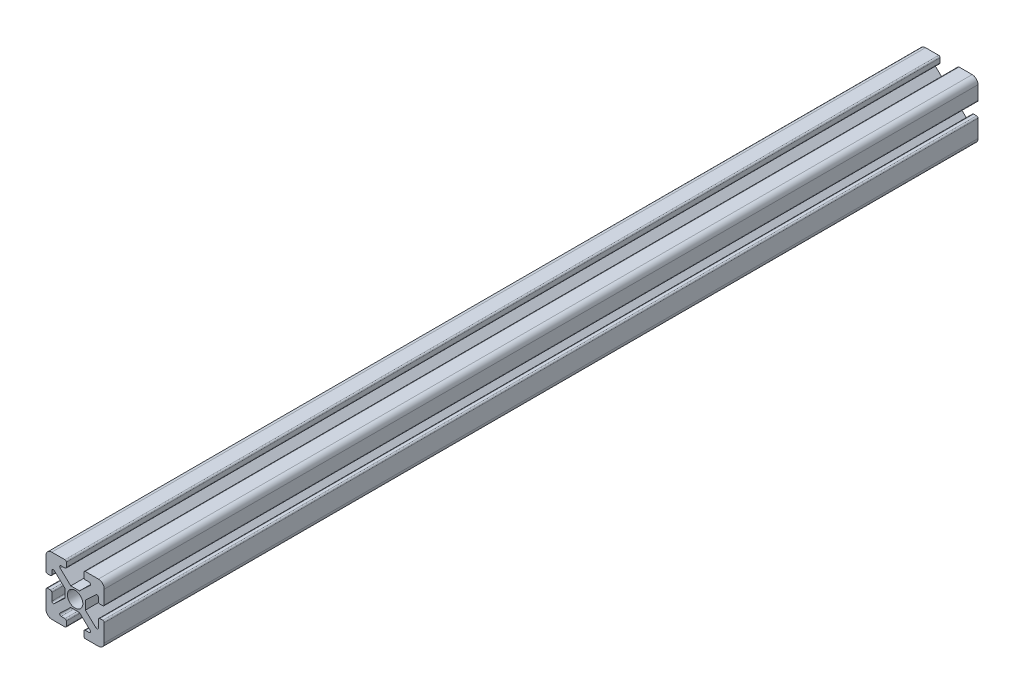
from build123d import *

# Parameters (mm, degrees)
SKETCH1_R           = 2.65
BOSS_EXTRUDE2_DEPTH = 300


with BuildPart() as part:
    # Sketch1 → Boss-Extrude2 (new body)
    with BuildSketch(Plane.XY):
        with BuildLine():
            Line((0, 2), (0, 8.007512652))
            ThreePointArc((0, 8.007512652), (0.146446609, 8.361066043), (0.5, 8.507512652))
            Line((0.5, 8.507512652), (1.5, 8.507512652))
            ThreePointArc((1.5, 8.507512652), (1.853553391, 8.361066043), (2, 8.007512652))
            Line((2, 8.007512652), (2, 5.451323229))
            ThreePointArc((2, 5.451323229), (2.301581692, 4.992378598), (2.842520699, 5.087071159))
            Line((2.842520699, 5.087071159), (6.485041399, 8.512278154))
            Line((6.485041399, 8.512278154), (6.485041399, 11.512278154))
            Line((6.485041399, 11.512278154), (2.842520699, 14.937485148))
            ThreePointArc((2.842520699, 14.937485148), (2.301581692, 15.03217771), (2, 14.573233078))
            Line((2, 14.573233078), (2, 13.307512652))
            ThreePointArc((2, 13.307512652), (1.853553391, 12.953959262), (1.5, 12.807512652))
            Line((1.5, 12.807512652), (0.5, 12.807512652))
            ThreePointArc((0.5, 12.807512652), (0.146446609, 12.953959262), (0, 13.307512652))
            Line((0, 13.307512652), (0, 18))
            ThreePointArc((0, 18), (0.585786438, 19.414213562), (2, 20))
            Line((2, 20), (6.5, 20))
            ThreePointArc((6.5, 20), (6.853553391, 19.853553391), (7, 19.5))
            Line((7, 19.5), (7, 18.017502122))
            ThreePointArc((7, 18.017502122), (6.853553391, 17.663948732), (6.5, 17.517502122))
            Line((6.5, 17.517502122), (5.2, 17.517502122))
            ThreePointArc((5.2, 17.517502122), (4.735174207, 17.201722052), (4.857479301, 16.653250052))
            Line((4.857479301, 16.653250052), (8.5, 13.228043058))
            Line((8.5, 13.228043058), (11.5, 13.228043058))
            Line((11.5, 13.228043058), (15.142520699, 16.653250052))
            ThreePointArc((15.142520699, 16.653250052), (15.264825793, 17.201722052), (14.8, 17.517502122))
            Line((14.8, 17.517502122), (13.5, 17.517502122))
            ThreePointArc((13.5, 17.517502122), (13.146446609, 17.663948732), (13, 18.017502122))
            Line((13, 18.017502122), (13, 19.5))
            ThreePointArc((13, 19.5), (13.146446609, 19.853553391), (13.5, 20))
            Line((13.5, 20), (18, 20))
            ThreePointArc((18, 20), (19.414213562, 19.414213562), (20, 18))
            Line((20, 18), (20, 13.307512652))
            ThreePointArc((20, 13.307512652), (19.853553391, 12.953959262), (19.5, 12.807512652))
            Line((19.5, 12.807512652), (18.5, 12.807512652))
            ThreePointArc((18.5, 12.807512652), (18.146446609, 12.953959262), (18, 13.307512652))
            Line((18, 13.307512652), (18, 14.573233078))
            ThreePointArc((18, 14.573233078), (17.698418308, 15.03217771), (17.157479301, 14.937485148))
            Line((17.157479301, 14.937485148), (13.514958601, 11.512278154))
            Line((13.514958601, 11.512278154), (13.514958601, 8.512278154))
            Line((13.514958601, 8.512278154), (17.157479301, 5.087071159))
            ThreePointArc((17.157479301, 5.087071159), (17.698418308, 4.992378598), (18, 5.451323229))
            Line((18, 5.451323229), (18, 8.007512652))
            ThreePointArc((18, 8.007512652), (18.146446609, 8.361066043), (18.5, 8.507512652))
            Line((18.5, 8.507512652), (19.5, 8.507512652))
            ThreePointArc((19.5, 8.507512652), (19.853553391, 8.361066043), (20, 8.007512652))
            Line((20, 8.007512652), (20, 2))
            ThreePointArc((20, 2), (19.414213562, 0.585786438), (18, 0))
            Line((18, 0), (13.5, 0))
            ThreePointArc((13.5, 0), (13.146446609, 0.146446609), (13, 0.5))
            Line((13, 0.5), (13, 2.007054185))
            ThreePointArc((13, 2.007054185), (13.146446609, 2.360607576), (13.5, 2.507054185))
            Line((13.5, 2.507054185), (14.8, 2.507054185))
            ThreePointArc((14.8, 2.507054185), (15.264825793, 2.822834256), (15.142520699, 3.371306255))
            Line((15.142520699, 3.371306255), (11.5, 6.79651325))
            Line((11.5, 6.79651325), (8.5, 6.79651325))
            Line((8.5, 6.79651325), (4.857479301, 3.371306255))
            ThreePointArc((4.857479301, 3.371306255), (4.735174207, 2.822834256), (5.2, 2.507054185))
            Line((5.2, 2.507054185), (6.5, 2.507054185))
            ThreePointArc((6.5, 2.507054185), (6.853553391, 2.360607576), (7, 2.007054185))
            Line((7, 2.007054185), (7, 0.5))
            ThreePointArc((7, 0.5), (6.853553391, 0.146446609), (6.5, 0))
            Line((6.5, 0), (2, 0))
            ThreePointArc((2, 0), (0.585786438, 0.585786438), (0, 2))
        make_face()
        with Locations((10, 10)):
            Circle(SKETCH1_R, mode=Mode.SUBTRACT)
    extrude(amount=BOSS_EXTRUDE2_DEPTH)


solid = part.part
